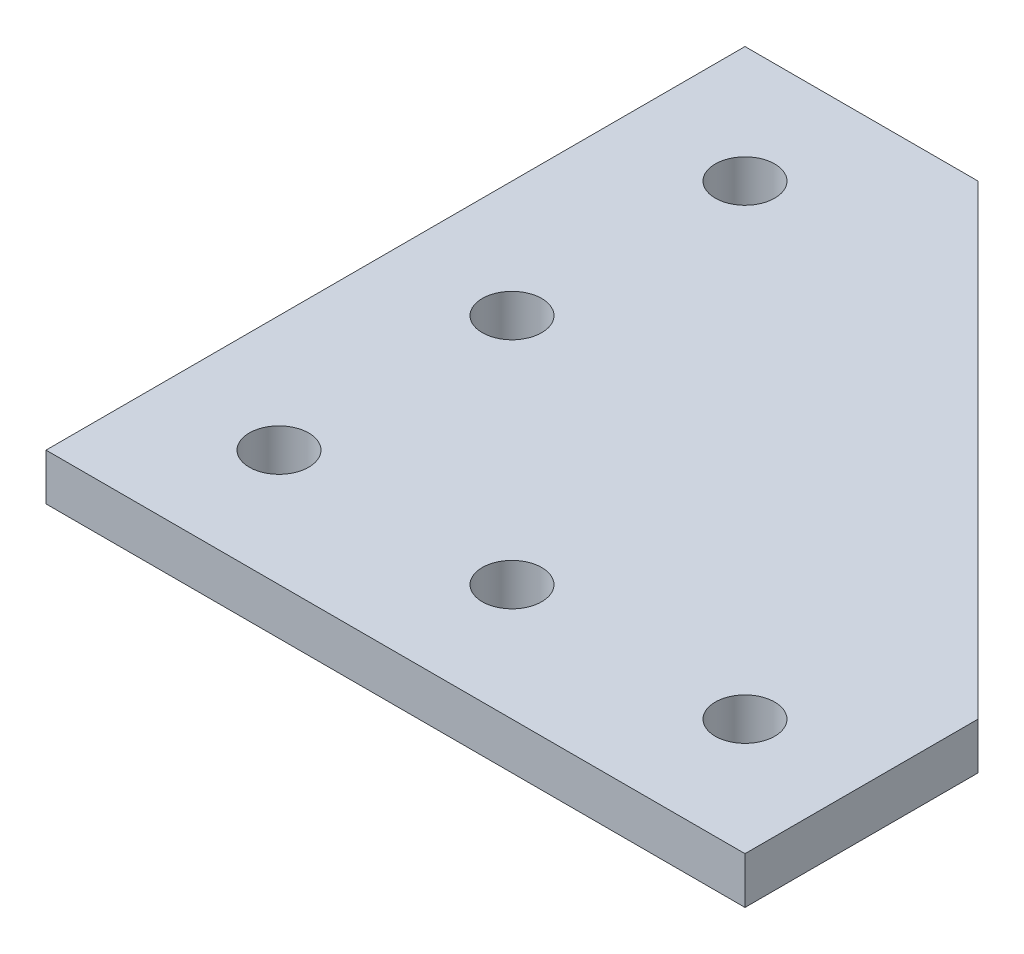
from build123d import *

# Parameters (mm, degrees)
SKETCH1_R           = 2.55
BOSS_EXTRUDE1_DEPTH = 4


with BuildPart() as part:
    # Sketch1 → Boss-Extrude1 (new body)
    with BuildSketch(Plane(origin=(0, 0, 0), x_dir=(1, 0, 0), z_dir=(0, 1, 0))):
        Polygon((0, 0), (60, 0), (60, 20), (20, 60), (0, 60), align=None)
        with Locations(Location((10, 10, 0), (0, 0, 270))):
            Circle(SKETCH1_R, mode=Mode.SUBTRACT)
        with Locations(Location((30, 10, 0), (0, 0, 270))):
            Circle(SKETCH1_R, mode=Mode.SUBTRACT)
        with Locations(Location((50, 10, 0), (0, 0, 270))):
            Circle(SKETCH1_R, mode=Mode.SUBTRACT)
        with Locations(Location((10, 30, 0), (0, 0, 270))):
            Circle(SKETCH1_R, mode=Mode.SUBTRACT)
        with Locations(Location((10, 50, 0), (0, 0, 270))):
            Circle(SKETCH1_R, mode=Mode.SUBTRACT)
    extrude(amount=BOSS_EXTRUDE1_DEPTH)


solid = part.part
